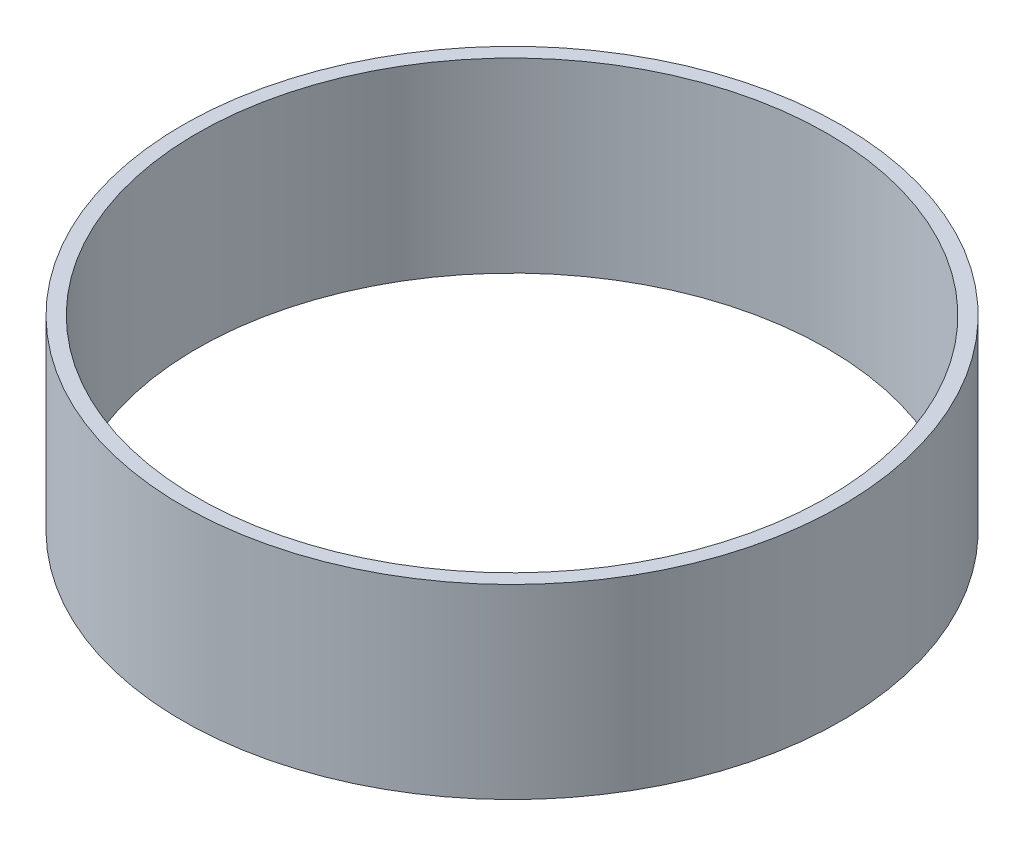
from build123d import *

# Parameters (mm, degrees)
SKICA1_R                = 46
SKICA1_R_2              = 44
P_IDAT_VYSUNUT_M1_DEPTH = 26


with BuildPart() as part:
    # Skica1 → Přidat vysunutím1 (new body)
    with BuildSketch(Plane(origin=(0, 0, 0), x_dir=(1, 0, 0), z_dir=(0, 1, 0))):
        with Locations(Location((0, 0, 0), (0, 0, 90))):
            Circle(SKICA1_R)
        with Locations(Location((0, 0, 0), (0, 0, 90))):
            Circle(SKICA1_R_2, mode=Mode.SUBTRACT)
    extrude(amount=P_IDAT_VYSUNUT_M1_DEPTH)


solid = part.part
